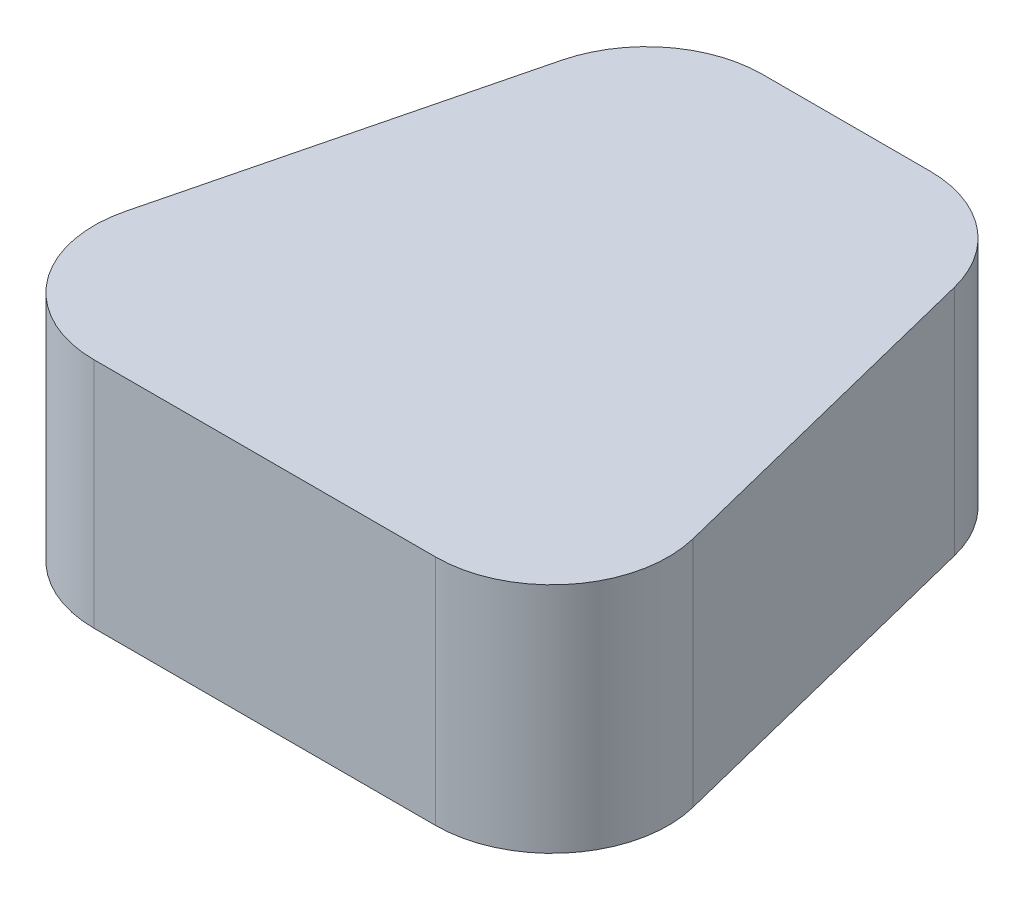
from build123d import *

# Parameters (mm, degrees)
FSHAPE1_DEPTH = 20
FRSHAPE1_R    = 10


with BuildPart() as part:
    # SShape1 → FShape1 (new body)
    with BuildSketch(Plane(origin=(0, 0, 0), x_dir=(1, 0, 0), z_dir=(0, 1, 0))):
        Polygon((-15, 25), (15, 25), (27.5, -25), (-27.5, -25), align=None)
    extrude(amount=FSHAPE1_DEPTH)

    # FRShape1
    frshape1_edges = [part.edges().sort_by_distance(p)[0] for p in [
        (-15, 10, -25),
        (15, 10, -25),
        (27.5, 10, 25),
        (-27.5, 10, 25),
    ]]
    fillet(frshape1_edges, radius=FRSHAPE1_R)


solid = part.part
